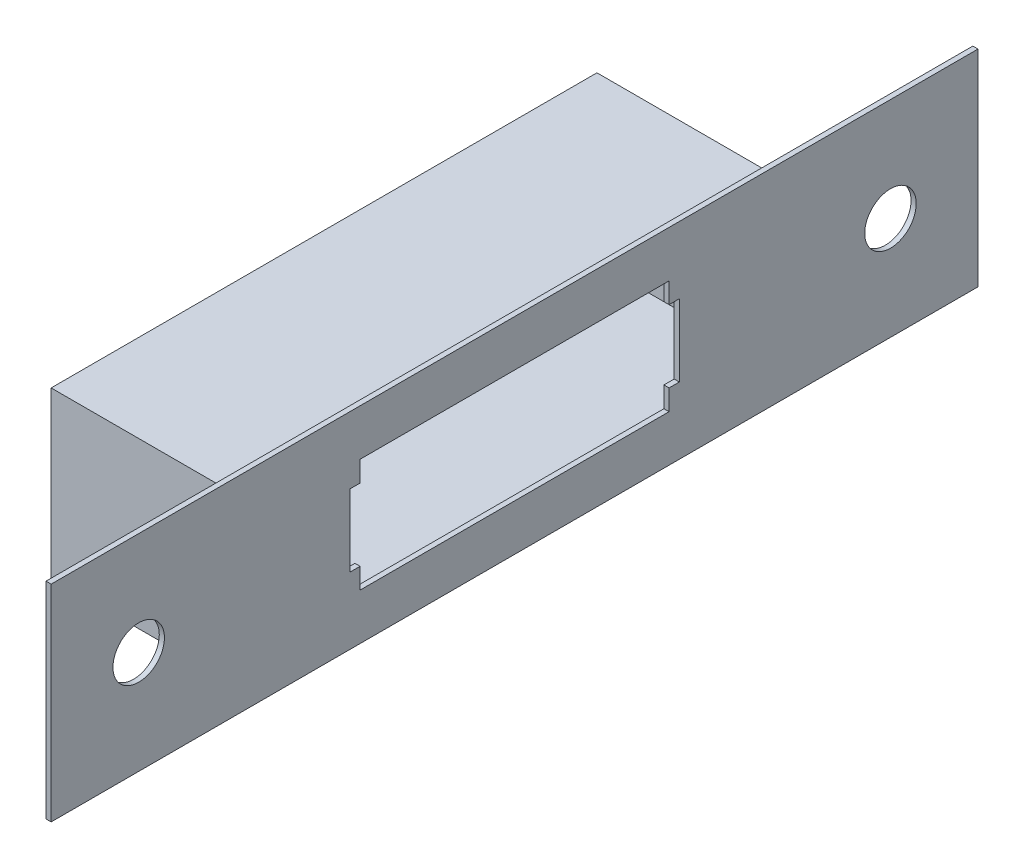
from build123d import *

# Parameters (mm, degrees)
SKETCH1_W           = 53
SKETCH1_H           = 16
BOSS_EXTRUDE1_DEPTH = 18
SHELL1_T            = -0.5
SKETCH2_W           = 90
SKETCH2_H           = 20
SKETCH2_R           = 2.5
BOSS_EXTRUDE2_DEPTH = 0.5


with BuildPart() as part:
    # Sketch1 → Boss-Extrude1 (new body)
    with BuildSketch(Plane(origin=(0, 0, 0), x_dir=(0, 0, -1), z_dir=(1, 0, 0))):
        Rectangle(SKETCH1_W, SKETCH1_H)
    extrude(amount=BOSS_EXTRUDE1_DEPTH)

    # Shell1
    shell1_openings = [part.faces().sort_by_distance(p)[0] for p in [
        (18, 0, 0),
    ]]
    offset(amount=SHELL1_T, openings=shell1_openings, kind=Kind.INTERSECTION)

    # Sketch2 → Boss-Extrude2 (add)
    with BuildSketch(Plane(origin=(18, 0, 0), x_dir=(0, 0, -1), z_dir=(1, 0, 0))):
        Rectangle(SKETCH2_W, SKETCH2_H)
        with Locations((36.5, 0)):
            Circle(SKETCH2_R, mode=Mode.SUBTRACT)
        with Locations((-36.5, 0)):
            Circle(SKETCH2_R, mode=Mode.SUBTRACT)
        Polygon((-16, 3.5), (-15, 3.5), (-15, 5.5), (15, 5.5), (15, 3.5), (16, 3.5), (16, -3.5), (15, -3.5), (15, -5.5), (-15, -5.5), (-15, -3.5), (-16, -3.5), align=None, mode=Mode.SUBTRACT)
    extrude(amount=BOSS_EXTRUDE2_DEPTH)


solid = part.part
